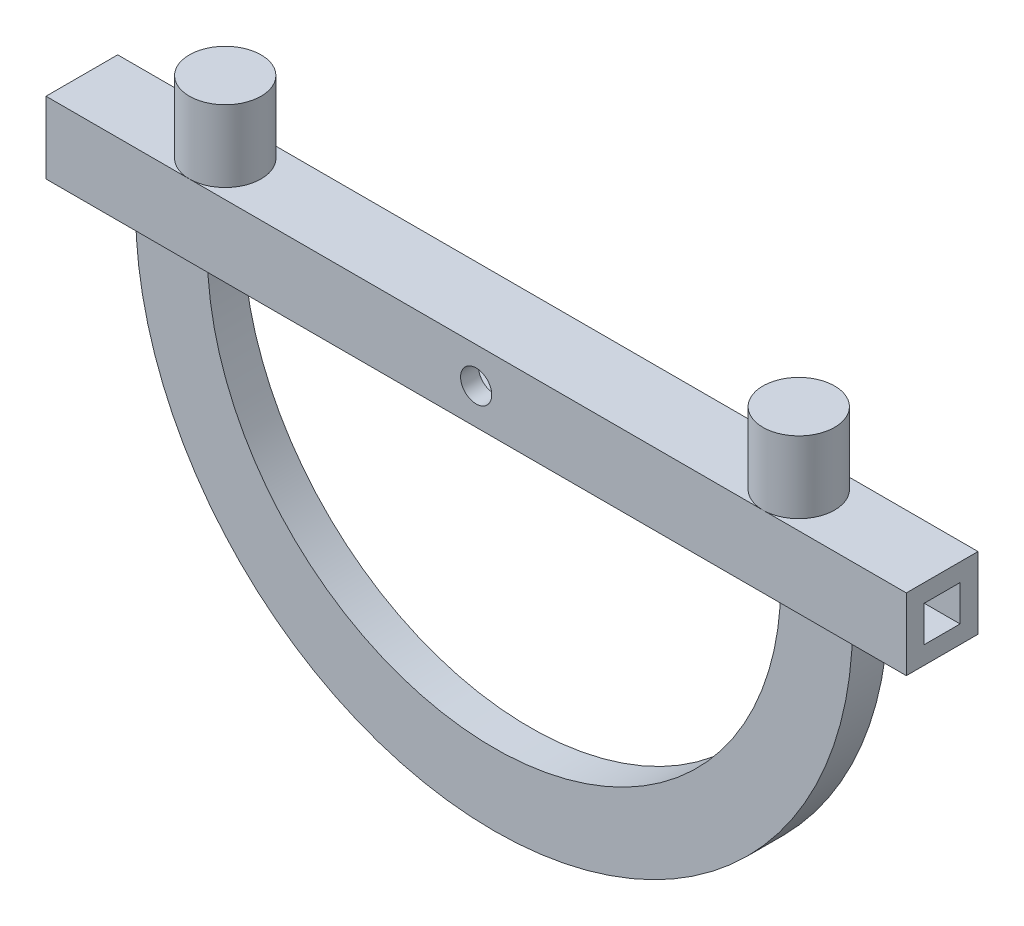
from build123d import *

# Parameters (mm, degrees)
BOSS_EXTRU_1_DEPTH      = 5
BOSS_EXTRU_1_DEPTH_BACK = 5
BOSS_EXTRU_2_DEPTH      = 120
BOSS_EXTRU_2_DEPTH_BACK = 120
ESQUISSE2_W             = 20
ESQUISSE2_H             = 20
ESQUISSE2_W_2           = 10
ESQUISSE2_H_2           = 10
ESQUISSE3_R             = 4.351117742
ENL_V_MAT_EXTRU_1_DEPTH = 120
ESQUISSE4_R             = 10
BOSS_EXTRU_3_DEPTH      = 20


with BuildPart() as part:
    # Esquisse1 → Boss.-Extru.1 (new, two sides: drawn at the far end of the back side and taken through both)
    with BuildSketch(Plane.XY.offset(-BOSS_EXTRU_1_DEPTH_BACK)):
        with BuildLine():
            Line((-100, 0), (-80, 0))
            ThreePointArc((-80, 0), (0, -80), (80, 0))
            Line((80, 0), (100, 0))
            ThreePointArc((100, 0), (0, -100), (-100, 0))
        make_face()
    extrude(amount=BOSS_EXTRU_1_DEPTH + BOSS_EXTRU_1_DEPTH_BACK)

    # Esquisse2 → Boss.-Extru.2 (add, two sides: drawn at the far end of the back side and taken through both)
    with BuildSketch(Plane(origin=(0, 0, 0), x_dir=(0, 0, -1), z_dir=(1, 0, 0)).offset(-BOSS_EXTRU_2_DEPTH_BACK)):
        with Locations((0, 10)):
            Rectangle(ESQUISSE2_W, ESQUISSE2_H)
        with Locations((0, 10)):
            Rectangle(ESQUISSE2_W_2, ESQUISSE2_H_2, mode=Mode.SUBTRACT)
    extrude(amount=BOSS_EXTRU_2_DEPTH + BOSS_EXTRU_2_DEPTH_BACK)

    # Esquisse3 → Enlèv. mat.-Extru.1 (cut)
    with BuildSketch(Plane(origin=(0, 0, -10), x_dir=(-1, 0, 0), z_dir=(0, 0, -1))):
        with Locations((0, 10)):
            Circle(ESQUISSE3_R)
    extrude(amount=-ENL_V_MAT_EXTRU_1_DEPTH, mode=Mode.SUBTRACT)

    # Esquisse4 → Boss.-Extru.3 (add)
    with BuildSketch(Plane(origin=(0, 20, 0), x_dir=(1, 0, 0), z_dir=(0, 1, 0))):
        with Locations((-80, 0)):
            Circle(ESQUISSE4_R)
        with Locations((80, 0)):
            Circle(ESQUISSE4_R)
    extrude(amount=BOSS_EXTRU_3_DEPTH)


solid = part.part
